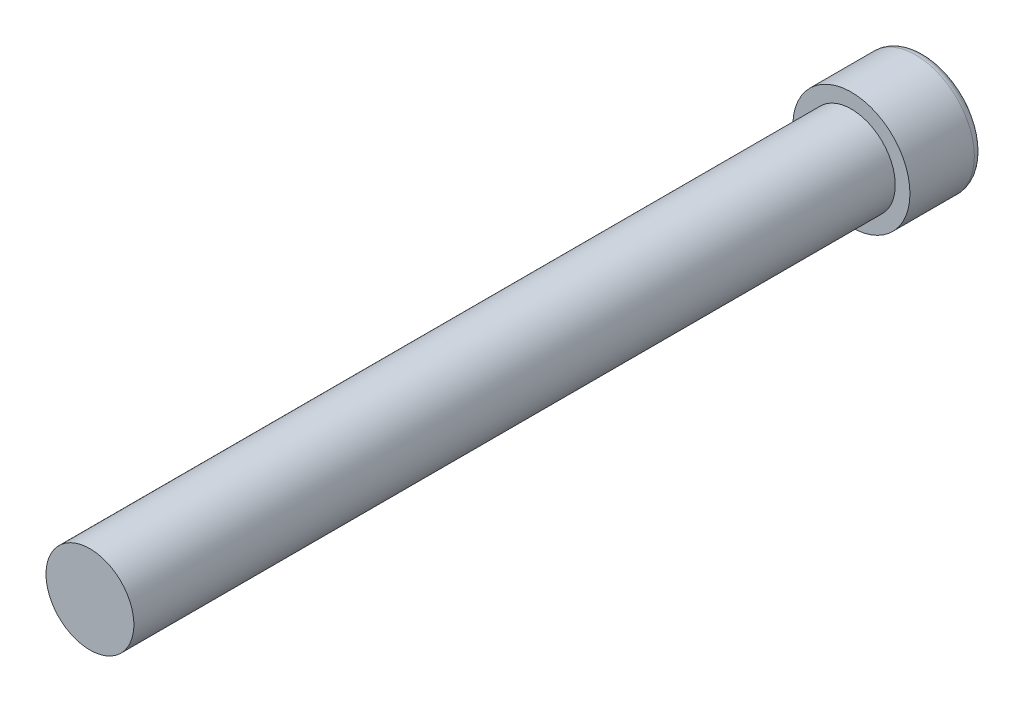
from build123d import *

# Parameters (mm, degrees)
ESQUISSE1_R             = 2
BASE_EXTRUSION_DEPTH    = 2.5
ESQUISSE2_R             = 1.5
BOSS_EXTRU_1_DEPTH      = 26
CONG_1_R                = 0.3
ENL_V_MAT_EXTRU_1_DEPTH = 2


with BuildPart() as part:
    # Esquisse1 → Base-Extrusion (new body)
    with BuildSketch(Plane.XY):
        Circle(ESQUISSE1_R)
    extrude(amount=BASE_EXTRUSION_DEPTH)

    # Esquisse2 → Boss.-Extru.1 (add)
    with BuildSketch(Plane.XY.offset(2.5)):
        with Locations(Location((0, 0, 0), (0, 0, 180))):
            Circle(ESQUISSE2_R)
    extrude(amount=BOSS_EXTRU_1_DEPTH)

    # Congé1
    cong_1_edges = [part.edges().sort_by_distance(p)[0] for p in [
        (-2, 0, 0),
    ]]
    fillet(cong_1_edges, radius=CONG_1_R)

    # Esquisse3 → Enlèv. mat.-Extru.1 (cut)
    with BuildSketch(Plane(origin=(0, 0, 0), x_dir=(-1, 0, 0), z_dir=(0, 0, -1))):
        Polygon((1.535751716, 0), (0.767875858, 1.33), (-0.767875858, 1.33), (-1.535751716, 0), (-0.767875858, -1.33), (0.767875858, -1.33), align=None)
    extrude(amount=-ENL_V_MAT_EXTRU_1_DEPTH, mode=Mode.SUBTRACT)


solid = part.part
